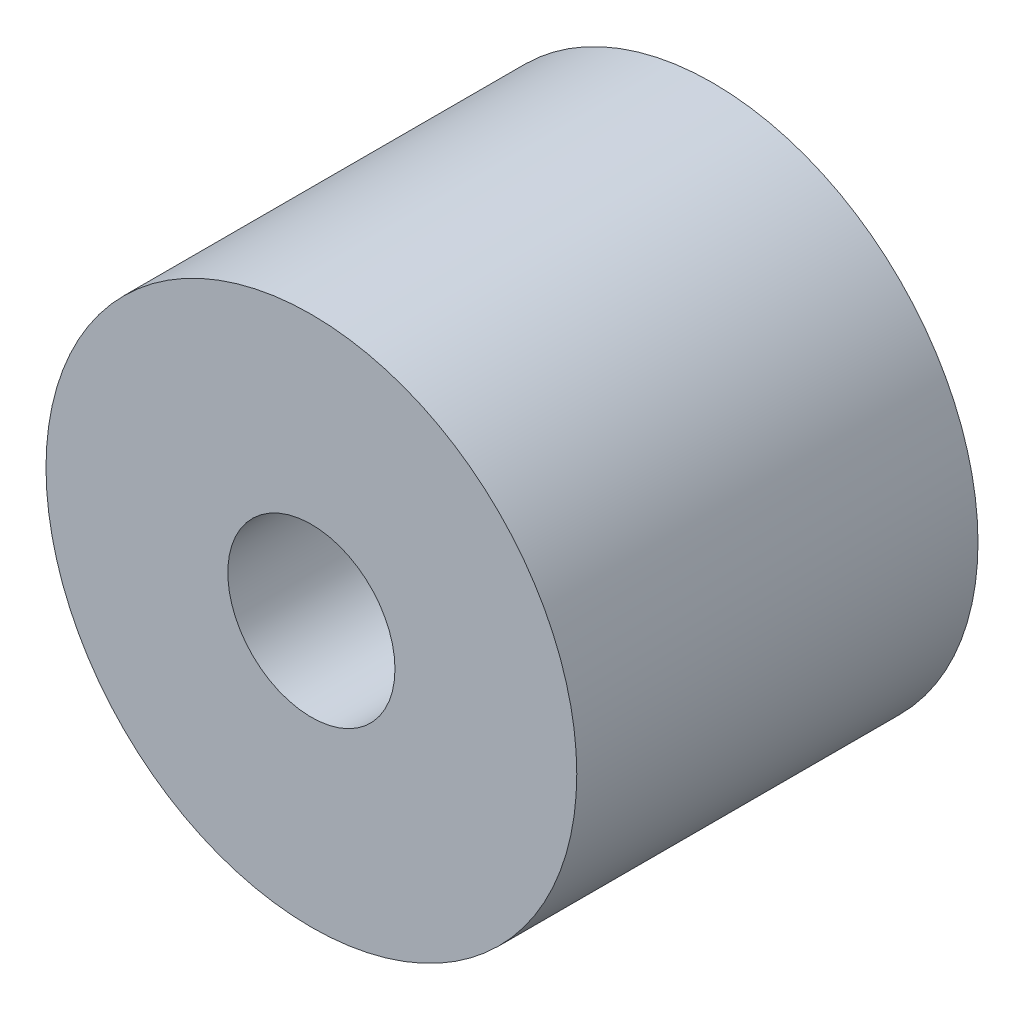
from build123d import *

# Parameters (mm, degrees)
SKETCH1_R                   = 3.96875
BOSS_EXTRUDE1_DEPTH         = 6
TAP_DRILL_FOR_M3X0_5_TAP1_D = 2.5


with BuildPart() as part:
    # Sketch1 → Boss-Extrude1 (new body)
    with BuildSketch(Plane.XY):
        Circle(SKETCH1_R)
    extrude(amount=BOSS_EXTRUDE1_DEPTH)

    # Tap Drill for M3x0.5 Tap1 (through all)
    with Locations(Plane.XY.offset(6)):
        with Locations((0, 0)):
            Hole(TAP_DRILL_FOR_M3X0_5_TAP1_D / 2)


solid = part.part
